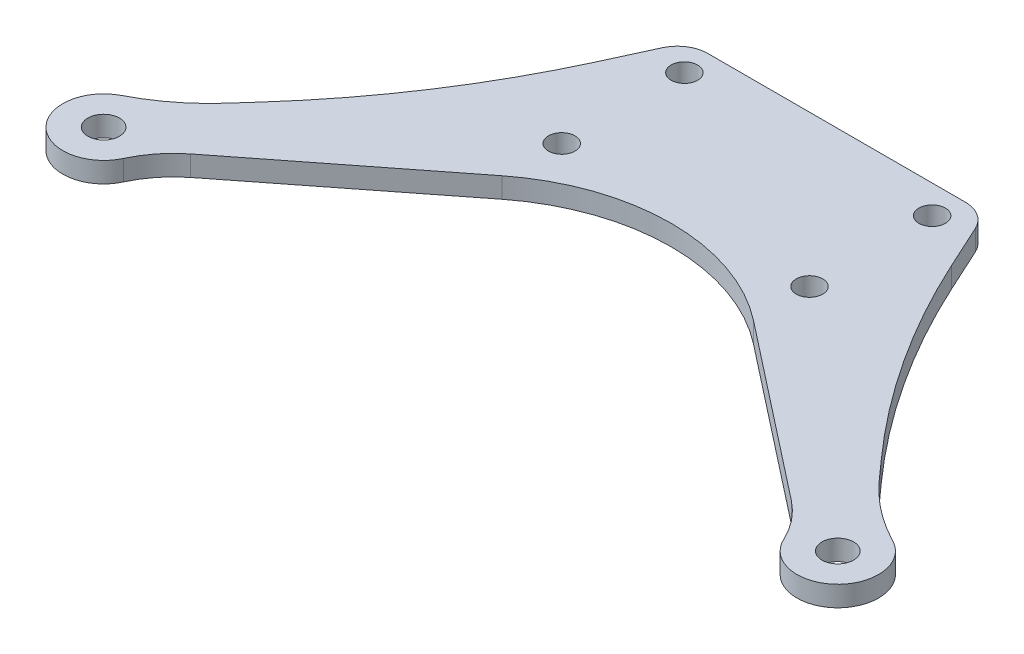
from build123d import *

# Parameters (mm, degrees)
SKETCH_1_R      = 1.55
SKETCH_1_R_2    = 1.3
EXTRUDE_1_DEPTH = 2


with BuildPart() as part:
    # 草图1 → 凸台-拉伸1 (new body)
    with BuildSketch(Plane(origin=(0, 0, 0), x_dir=(1, 0, 0), z_dir=(0, 1, 0))):
        with BuildLine():
            Line((-30.40246304, 52.857720294), (-32.037278544, 51.028700347))
            ThreePointArc((-32.037278544, 51.028700347), (-34.725061467, 48.527352956), (-37.824815498, 46.559501145))
            ThreePointArc((-37.824815498, 46.559501145), (-39.603619628, 44.736066121), (-39.92091739, 42.208541335))
            ThreePointArc((-39.92091739, 42.208541335), (-36.468177596, 39.027493268), (-32.370509151, 41.318692124))
            ThreePointArc((-32.370509151, 41.318692124), (-31.135199663, 43.325028618), (-29.464750167, 44.986646546))
            Line((-29.464750167, 44.986646546), (-12.33593628, 58.408952508))
            ThreePointArc((-12.33593628, 58.408952508), (0, 62.666504283), (12.33593628, 58.408952508))
            Line((12.33593628, 58.408952508), (29.464750167, 44.986646546))
            ThreePointArc((29.464750167, 44.986646546), (31.135199663, 43.325028618), (32.370509151, 41.318692124))
            ThreePointArc((32.370509151, 41.318692124), (36.468177596, 39.027493268), (39.92091739, 42.208541335))
            ThreePointArc((39.92091739, 42.208541335), (39.603619628, 44.736066121), (37.824815498, 46.559501145))
            ThreePointArc((37.824815498, 46.559501145), (34.725061467, 48.527352956), (32.037278544, 51.028700347))
            Line((32.037278544, 51.028700347), (30.40246304, 52.857720294))
            ThreePointArc((30.40246304, 52.857720294), (23.129287971, 62.333031959), (17.34800881, 72.785659285))
            Line((17.34800881, 72.785659285), (15.34970392, 77.137234504))
            ThreePointArc((15.34970392, 77.137234504), (14.242702771, 78.410741128), (12.62341972, 78.885286238))
            Line((12.62341972, 78.885286238), (-12.62341972, 78.885286238))
            ThreePointArc((-12.62341972, 78.885286238), (-14.242702771, 78.410741128), (-15.34970392, 77.137234504))
            Line((-15.34970392, 77.137234504), (-17.34800881, 72.785659285))
            ThreePointArc((-17.34800881, 72.785659285), (-23.129287971, 62.333031959), (-30.40246304, 52.857720294))
        make_face()
        with Locations(Location((-36, 43, 0), (0, 0, 270))):
            Circle(SKETCH_1_R, mode=Mode.SUBTRACT)
        with Locations(Location((36, 43, 0), (0, 0, 270))):
            Circle(SKETCH_1_R, mode=Mode.SUBTRACT)
        with Locations(Location((-12.15, 64.075512735, 0), (0, 0, 270))):
            Circle(SKETCH_1_R_2, mode=Mode.SUBTRACT)
        with Locations(Location((-12.15, 76.105512735, 0), (0, 0, 270))):
            Circle(SKETCH_1_R_2, mode=Mode.SUBTRACT)
        with Locations(Location((12.15, 64.075512735, 0), (0, 0, 270))):
            Circle(SKETCH_1_R_2, mode=Mode.SUBTRACT)
        with Locations(Location((12.15, 76.105512735, 0), (0, 0, 270))):
            Circle(SKETCH_1_R_2, mode=Mode.SUBTRACT)
    extrude(amount=EXTRUDE_1_DEPTH)


solid = part.part
